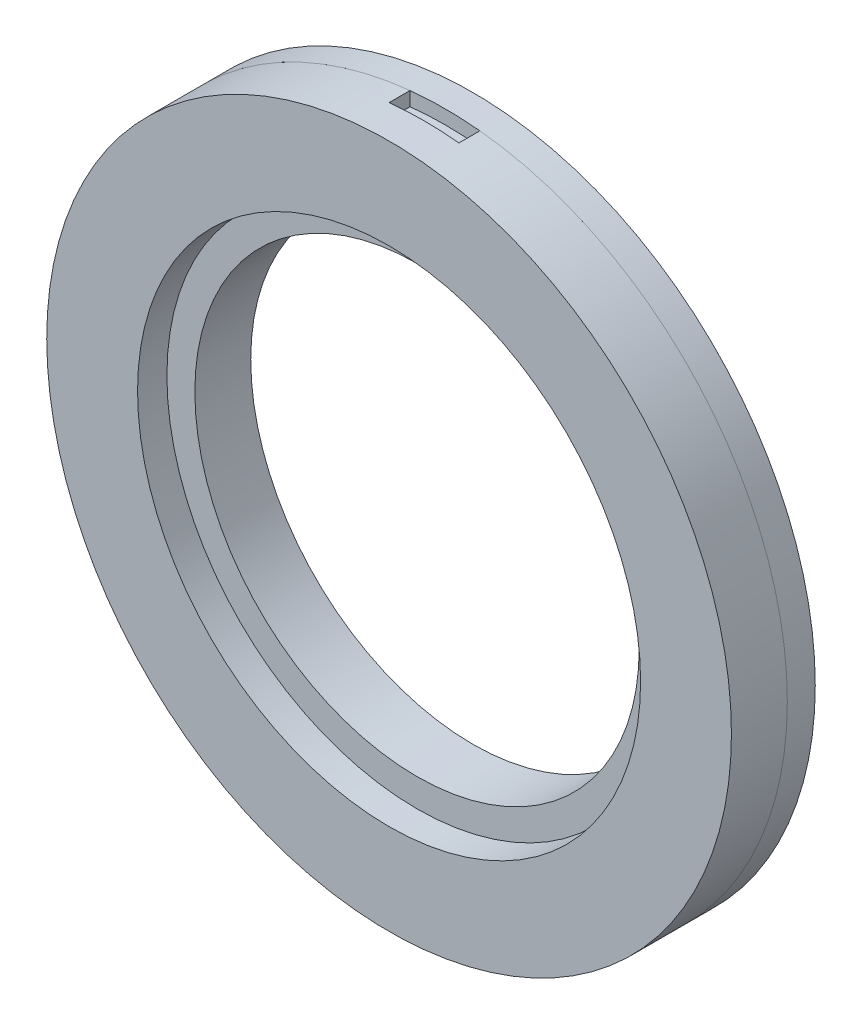
from build123d import *

# Parameters (mm, degrees)
SKETCH1_R               = 24.5
SKETCH1_R_2             = 18
BOSS_EXTRUDE1_DEPTH     = 4
SKETCH3_R               = 22.5
SKETCH3_R_2             = 20
CUT_EXTRUDE1_DEPTH      = 2
SKETCH4_R               = 24.5
BOSS_EXTRUDE2_DEPTH     = 2
SKETCH5_R               = 17.9
BOSS_EXTRUDE3_DEPTH     = 2
SKETCH8_R               = 15.9
CUT_EXTRUDE2_DEPTH      = 35.878360053
CUT_EXTRUDE3_REACH      = 136.878
CUT_EXTRUDE3_END_RADIUS = 23.5
CUT_EXTRUDE3_START      = -100
SKETCH9_W               = 2.5
SKETCH9_H               = 1.5


with BuildPart() as part:
    # Sketch1 → Boss-Extrude1 (new body)
    with BuildSketch(Plane.XY):
        Circle(SKETCH1_R)
        Circle(SKETCH1_R_2, mode=Mode.SUBTRACT)
    extrude(amount=BOSS_EXTRUDE1_DEPTH)

    # Sketch3 → Cut-Extrude1 (cut)
    with BuildSketch(Plane.XY):
        Circle(SKETCH3_R)
        Circle(SKETCH3_R_2, mode=Mode.SUBTRACT)
    extrude(amount=CUT_EXTRUDE1_DEPTH, mode=Mode.SUBTRACT)

    # Cut-Extrude3: up to this cylinder (the profile starts outside it)
    cut_extrude3_end = Plane(origin=(0, 0, 0.75), z_dir=(0, 0, -1)) * Cylinder(CUT_EXTRUDE3_END_RADIUS, 321.756, mode=Mode.PRIVATE)
    # Sketch9 → Cut-Extrude3 (cut, up to the surface)
    with BuildSketch(Plane(origin=(0, 0, 0), x_dir=(1, 0, 0), z_dir=(0, 1, 0)).offset(CUT_EXTRUDE3_START), mode=Mode.PRIVATE) as cut_extrude3_sk1:
        with Locations((-1.25, -0.75)):
            Rectangle(SKETCH9_W, SKETCH9_H)
    cut_extrude3_tool1 = extrude(cut_extrude3_sk1.sketch, amount=CUT_EXTRUDE3_REACH, mode=Mode.PRIVATE) - cut_extrude3_end
    # Sketch9 → Cut-Extrude3 (cut, up to the surface)
    with BuildSketch(Plane(origin=(0, 0, 0), x_dir=(1, 0, 0), z_dir=(0, 1, 0)).offset(CUT_EXTRUDE3_START), mode=Mode.PRIVATE) as cut_extrude3_sk2:
        with Locations((1.25, -0.75)):
            Rectangle(SKETCH9_W, SKETCH9_H)
    cut_extrude3_tool2 = extrude(cut_extrude3_sk2.sketch, amount=CUT_EXTRUDE3_REACH, mode=Mode.PRIVATE) - cut_extrude3_end
    cut_extrude3 = cut_extrude3_tool1.solids().sort_by_distance((-1.25, -100, 0.75))[0] + cut_extrude3_tool2.solids().sort_by_distance((1.25, -100, 0.75))[0]
    add(cut_extrude3, mode=Mode.SUBTRACT)

    # Mirror1: Cut-Extrude3 across plane
    add(cut_extrude3.mirror(Plane.ZX), mode=Mode.SUBTRACT)


with BuildPart() as body_2:
    # Sketch4 → Boss-Extrude2 (new body)
    with BuildSketch(Plane(origin=(0, 0, 0), x_dir=(-1, 0, 0), z_dir=(0, 0, -1))):
        with Locations(Location((0, 0, 0), (0, 0, 180))):
            Circle(SKETCH4_R)
    extrude(amount=BOSS_EXTRUDE2_DEPTH)


with BuildPart() as body_3:
    # Sketch5 → Boss-Extrude3 (new body)
    with BuildSketch(Plane.XY):
        Circle(SKETCH5_R)
    extrude(amount=BOSS_EXTRUDE3_DEPTH)


with BuildPart() as body_2_1:
    add(body_2.part)

    # Combine1: union body 3
    add(body_3.part)

    # Sketch8 → Cut-Extrude2 (cut, through all)
    with BuildSketch(Plane.XY.offset(2)):
        Circle(SKETCH8_R)
    extrude(amount=-CUT_EXTRUDE2_DEPTH, mode=Mode.SUBTRACT)


with BuildPart() as body_3_2:
    # Sketch6 → Revolve1 (revolve)
    with BuildSketch(Plane(origin=(0, 0, 0), x_dir=(1, 0, 0), z_dir=(0, 1, 0))):
        with BuildLine():
            Line((-22.5, 0), (-20, 0))
            add(Edge.make_bspline(
                [(-22.5, 0), (-21.25, -0.4), (-20, 0)],
                knots=[0, 0, 0, 1, 1, 1], degree=2))
        make_face()
    revolve(axis=Axis((0, 0, -2), (0, 0, 1)))


with BuildPart() as body_2_2:
    add(body_2_1.part)

    # Combine3: union body 3 2
    add(body_3_2.part)


solid = Compound([part.part, body_2_2.part])
